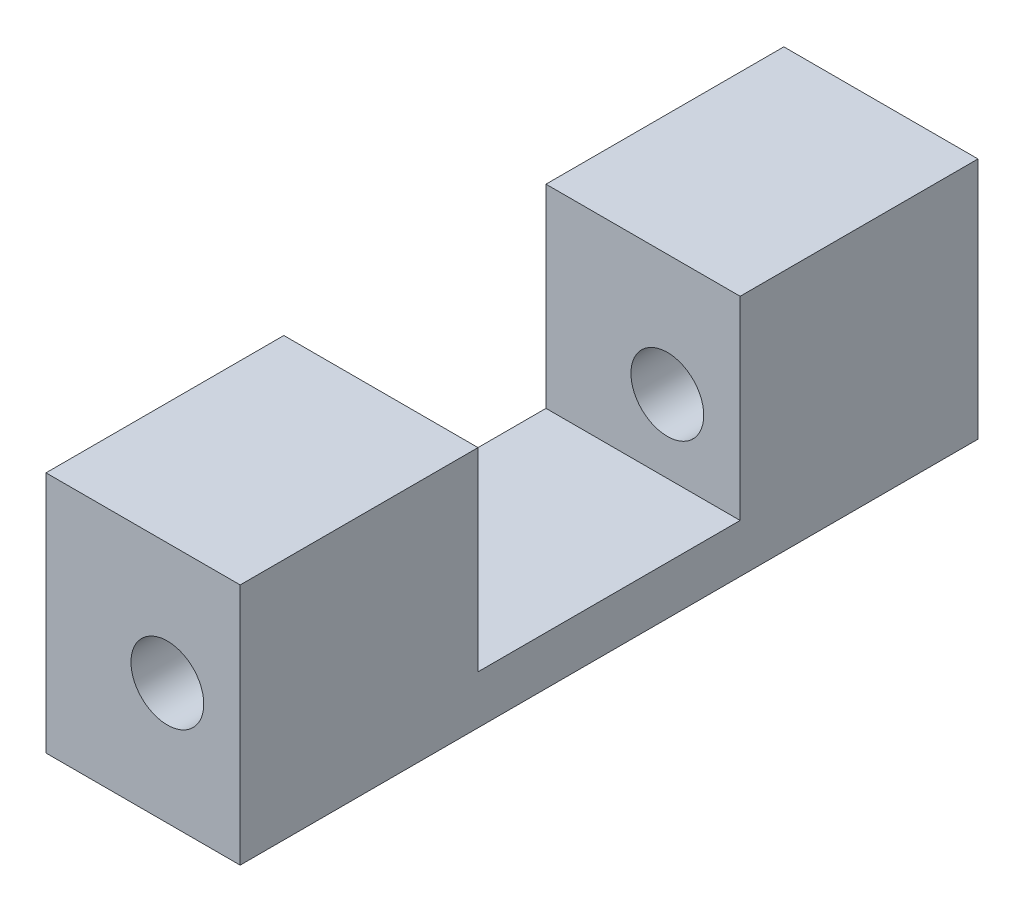
from build123d import *

# Parameters (mm, degrees)
SKETCH1_W           = 4
SKETCH1_H           = 15.2
BOSS_EXTRUDE1_DEPTH = 1
SKETCH2_W           = 4
SKETCH2_H           = 4.9
BOSS_EXTRUDE2_DEPTH = 4
CUT_EXTRUDE2_REACH  = 18.126
SKETCH4_R           = 0.75


with BuildPart() as part:
    # Sketch1 → Boss-Extrude1 (new body)
    with BuildSketch(Plane(origin=(0, 0, 0), x_dir=(1, 0, 0), z_dir=(0, 1, 0))):
        Rectangle(SKETCH1_W, SKETCH1_H)
    extrude(amount=BOSS_EXTRUDE1_DEPTH)

    # Sketch2 → Boss-Extrude2 (add)
    with BuildSketch(Plane(origin=(0, 1, 0), x_dir=(1, 0, 0), z_dir=(0, 1, 0))):
        with Locations((0, -5.15)):
            Rectangle(SKETCH2_W, SKETCH2_H)
    boss_extrude2 = extrude(amount=BOSS_EXTRUDE2_DEPTH)

    # Sketch4 → Cut-Extrude2 (cut, up to next)
    with BuildSketch(Plane.XY.offset(7.6), mode=Mode.PRIVATE) as cut_extrude2_sk1:
        with Locations((0.5, 2.5)):
            Circle(SKETCH4_R)
    cut_extrude2_tool1 = extrude(cut_extrude2_sk1.sketch, amount=-CUT_EXTRUDE2_REACH, mode=Mode.PRIVATE) & part.part
    cut_extrude2 = cut_extrude2_tool1.solids().sort_by_distance((0.5, 2.5, 7.6))[0]
    add(cut_extrude2, mode=Mode.SUBTRACT)

    # Mirror3: Boss-Extrude2, Cut-Extrude2 across plane
    add(boss_extrude2.mirror(Plane.XY))
    add(cut_extrude2.mirror(Plane.XY), mode=Mode.SUBTRACT)


solid = part.part
